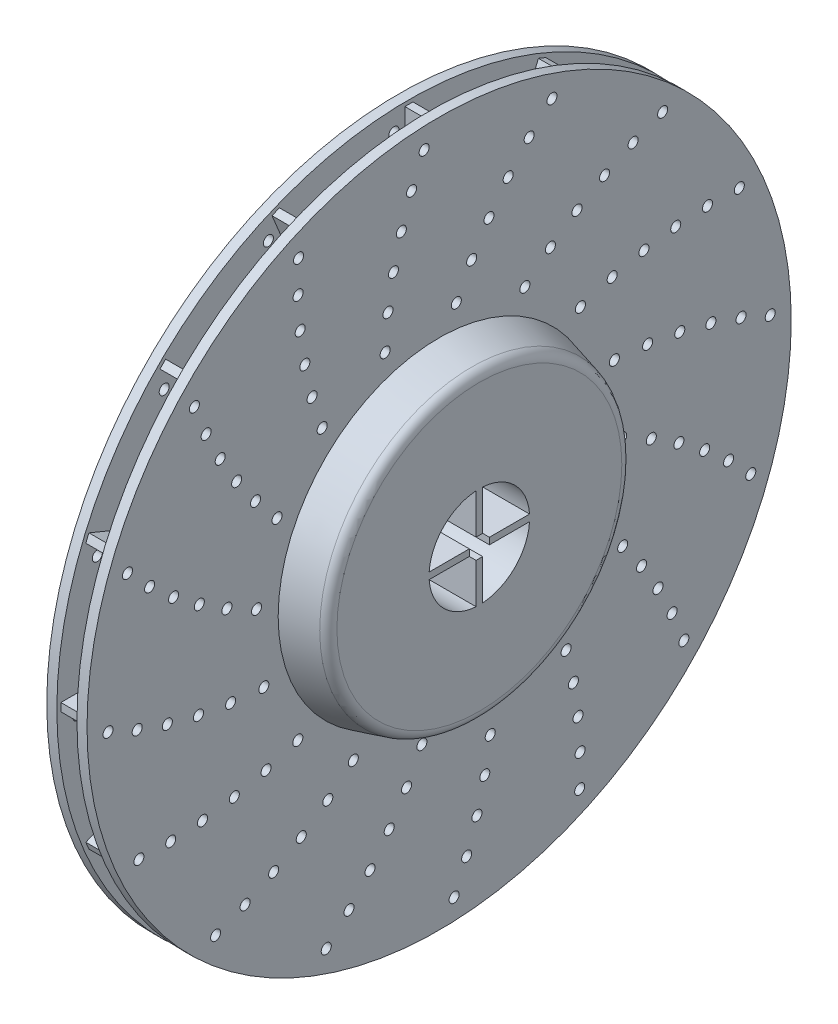
from build123d import *

# Parameters (mm, degrees)
Y_KSEKLIK_EKSTR_ZYON1_DEPTH   = 30
Y_KSEKLIK_EKSTR_ZYON1_2_DEPTH = 30
Y_KSEKLIK_EKSTR_ZYON1_3_DEPTH = 30
Y_KSEKLIK_EKSTR_ZYON1_4_DEPTH = 30
IZIM3_R                       = 25
IZIM3_R_2                     = 12.5
Y_KSEKLIK_EKSTR_ZYON2_DEPTH   = 30
Y_KSEKLIK_EKSTR_ZYON5_START   = -20
IZIM4_R                       = 87.5
IZIM4_R_2                     = 25
Y_KSEKLIK_EKSTR_ZYON5_DEPTH   = 10
IZIM9_R                       = 87.5
IZIM9_R_2                     = 37.5
KES_EKSTR_ZYON1_DEPTH         = 2.5
Y_KSEKLIK_EKSTR_ZYON9_DEPTH   = 2.5
IZIM14_R                      = 1.25
KES_EKSTR_ZYON2_DEPTH         = 5


with BuildPart() as part:
    # Çizim2 → Yükseklik-Ekstrüzyon1 (new body)
    with BuildSketch(Plane(origin=(0, 0, 0), x_dir=(0, 0, -1), z_dir=(1, 0, 0))):
        with BuildLine():
            Line((0.820112771, 2.5), (0.820112771, 12.473067587))
            ThreePointArc((0.820112771, 12.473067587), (0, 12.5), (-0.820112771, 12.473067587))
            Line((-0.820112771, 12.473067587), (-0.820112771, 2.5))
            Line((-0.820112771, 2.5), (0.820112771, 2.5))
        make_face()
    extrude(amount=Y_KSEKLIK_EKSTR_ZYON1_DEPTH)



with BuildPart() as body_2:
    # Çizim2 → Y_kseklik-Ekstr_zyon1 2 (new body)
    with BuildSketch(Plane(origin=(0, 0, 0), x_dir=(0, 0, -1), z_dir=(1, 0, 0))):
        with BuildLine():
            Line((12.473067587, 0.820112771), (2.5, 0.820112771))
            Line((2.5, 0.820112771), (2.5, -0.820112771))
            Line((2.5, -0.820112771), (12.473067587, -0.820112771))
            ThreePointArc((12.473067587, -0.820112771), (12.5, 0), (12.473067587, 0.820112771))
        make_face()
    extrude(amount=Y_KSEKLIK_EKSTR_ZYON1_2_DEPTH)


with BuildPart() as body_3:
    # Çizim2 → Y_kseklik-Ekstr_zyon1 3 (new body)
    with BuildSketch(Plane(origin=(0, 0, 0), x_dir=(0, 0, -1), z_dir=(1, 0, 0))):
        with BuildLine():
            Line((-2.5, 0.820112771), (-12.473067587, 0.820112771))
            ThreePointArc((-12.473067587, 0.820112771), (-12.5, 0), (-12.473067587, -0.820112771))
            Line((-12.473067587, -0.820112771), (-2.5, -0.820112771))
            Line((-2.5, -0.820112771), (-2.5, 0.820112771))
        make_face()
    extrude(amount=Y_KSEKLIK_EKSTR_ZYON1_3_DEPTH)


with BuildPart() as body_4:
    # Çizim2 → Y_kseklik-Ekstr_zyon1 4 (new body)
    with BuildSketch(Plane(origin=(0, 0, 0), x_dir=(0, 0, -1), z_dir=(1, 0, 0))):
        with BuildLine():
            Line((-0.820112771, -2.5), (-0.820112771, -12.473067587))
            ThreePointArc((-0.820112771, -12.473067587), (0, -12.5), (0.820112771, -12.473067587))
            Line((0.820112771, -12.473067587), (0.820112771, -2.5))
            Line((0.820112771, -2.5), (-0.820112771, -2.5))
        make_face()
    extrude(amount=Y_KSEKLIK_EKSTR_ZYON1_4_DEPTH)


with BuildPart() as part_1:
    add(part.part)

    add(body_2.part)  # Yükseklik-Ekstrüzyon2 merges body 2

    add(body_3.part)  # Yükseklik-Ekstrüzyon2 merges body 3

    add(body_4.part)  # Yükseklik-Ekstrüzyon2 merges body 4
    # Çizim3 → Yükseklik-Ekstrüzyon2 (add)
    with BuildSketch(Plane(origin=(0, 0, 0), x_dir=(0, 0, -1), z_dir=(1, 0, 0))):
        Circle(IZIM3_R)
        Circle(IZIM3_R_2, mode=Mode.SUBTRACT)
    extrude(amount=Y_KSEKLIK_EKSTR_ZYON2_DEPTH)

    # Çizim4 → Yükseklik-Ekstrüzyon5 (add)
    with BuildSketch(Plane(origin=(30, 0, 0), x_dir=(0, 0, -1), z_dir=(1, 0, 0)).offset(Y_KSEKLIK_EKSTR_ZYON5_START)):
        Circle(IZIM4_R)
        Circle(IZIM4_R_2, mode=Mode.SUBTRACT)
    extrude(amount=Y_KSEKLIK_EKSTR_ZYON5_DEPTH)

    # Çizim9 → Kes-Ekstrüzyon1 (cut, symmetric)
    with BuildSketch(Plane(origin=(15, 0, 0), x_dir=(0, 0, -1), z_dir=(1, 0, 0))):
        Circle(IZIM9_R)
        Circle(IZIM9_R_2, mode=Mode.SUBTRACT)
    extrude(amount=KES_EKSTR_ZYON1_DEPTH, both=True, mode=Mode.SUBTRACT)

    # Çizim10 → Yükseklik-Ekstrüzyon9 (add, symmetric)
    with BuildSketch(Plane(origin=(15, 0, 0), x_dir=(0, 0, -1), z_dir=(1, 0, 0))):
        with BuildLine():
            Line((1, 37.486664295), (1, 86.49421946))
            ThreePointArc((1, 86.49421946), (0, 86.5), (-1, 86.49421946))
            Line((-1, 86.49421946), (-1, 37.486664295))
            ThreePointArc((-1, 37.486664295), (0, 37.5), (1, 37.486664295))
        make_face()
        with BuildLine():
            Line((15.269404893, 34.250478452), (34.023784315, 79.527555607))
            ThreePointArc((34.023784315, 79.527555607), (33.1021169, 79.915579562), (32.17602525, 80.292922472))
            Line((32.17602525, 80.292922472), (13.421645828, 35.015845317))
            ThreePointArc((13.421645828, 35.015845317), (14.350628714, 34.645482469), (15.269404893, 34.250478452))
        make_face()
        with BuildLine():
            Line((27.214181309, 25.799967746), (61.867755895, 60.453542332))
            ThreePointArc((61.867755895, 60.453542332), (61.164736573, 61.164736573), (60.453542332, 61.867755895))
            Line((60.453542332, 61.867755895), (25.799967746, 27.214181309))
            ThreePointArc((25.799967746, 27.214181309), (26.516504294, 26.516504294), (27.214181309, 25.799967746))
        make_face()
        with BuildLine():
            Line((35.015845317, 13.421645828), (80.292922472, 32.17602525))
            ThreePointArc((80.292922472, 32.17602525), (79.915579562, 33.1021169), (79.527555607, 34.023784315))
            Line((79.527555607, 34.023784315), (34.250478452, 15.269404893))
            ThreePointArc((34.250478452, 15.269404893), (34.645482469, 14.350628714), (35.015845317, 13.421645828))
        make_face()
        with BuildLine():
            Line((37.486664295, -1), (86.49421946, -1))
            ThreePointArc((86.49421946, -1), (86.5, 0), (86.49421946, 1))
            Line((86.49421946, 1), (37.486664295, 1))
            ThreePointArc((37.486664295, 1), (37.5, 0), (37.486664295, -1))
        make_face()
        with BuildLine():
            Line((34.250478452, -15.269404893), (79.527555607, -34.023784315))
            ThreePointArc((79.527555607, -34.023784315), (79.915579562, -33.1021169), (80.292922472, -32.17602525))
            Line((80.292922472, -32.17602525), (35.015845317, -13.421645828))
            ThreePointArc((35.015845317, -13.421645828), (34.645482469, -14.350628714), (34.250478452, -15.269404893))
        make_face()
        with BuildLine():
            Line((25.799967746, -27.214181309), (60.453542332, -61.867755895))
            ThreePointArc((60.453542332, -61.867755895), (61.164736573, -61.164736573), (61.867755895, -60.453542332))
            Line((61.867755895, -60.453542332), (27.214181309, -25.799967746))
            ThreePointArc((27.214181309, -25.799967746), (26.516504294, -26.516504294), (25.799967746, -27.214181309))
        make_face()
        with BuildLine():
            Line((13.421645828, -35.015845317), (32.17602525, -80.292922472))
            ThreePointArc((32.17602525, -80.292922472), (33.1021169, -79.915579562), (34.023784315, -79.527555607))
            Line((34.023784315, -79.527555607), (15.269404893, -34.250478452))
            ThreePointArc((15.269404893, -34.250478452), (14.350628714, -34.645482469), (13.421645828, -35.015845317))
        make_face()
        with BuildLine():
            Line((-1, -37.486664295), (-1, -86.49421946))
            ThreePointArc((-1, -86.49421946), (0, -86.5), (1, -86.49421946))
            Line((1, -86.49421946), (1, -37.486664295))
            ThreePointArc((1, -37.486664295), (0, -37.5), (-1, -37.486664295))
        make_face()
        with BuildLine():
            Line((-15.269404893, -34.250478452), (-34.023784315, -79.527555607))
            ThreePointArc((-34.023784315, -79.527555607), (-33.1021169, -79.915579562), (-32.17602525, -80.292922472))
            Line((-32.17602525, -80.292922472), (-13.421645828, -35.015845317))
            ThreePointArc((-13.421645828, -35.015845317), (-14.350628714, -34.645482469), (-15.269404893, -34.250478452))
        make_face()
        with BuildLine():
            Line((-27.214181309, -25.799967746), (-61.867755895, -60.453542332))
            ThreePointArc((-61.867755895, -60.453542332), (-61.164736573, -61.164736573), (-60.453542332, -61.867755895))
            Line((-60.453542332, -61.867755895), (-25.799967746, -27.214181309))
            ThreePointArc((-25.799967746, -27.214181309), (-26.516504294, -26.516504294), (-27.214181309, -25.799967746))
        make_face()
        with BuildLine():
            Line((-35.015845317, -13.421645828), (-80.292922472, -32.17602525))
            ThreePointArc((-80.292922472, -32.17602525), (-79.915579562, -33.1021169), (-79.527555607, -34.023784315))
            Line((-79.527555607, -34.023784315), (-34.250478452, -15.269404893))
            ThreePointArc((-34.250478452, -15.269404893), (-34.645482469, -14.350628714), (-35.015845317, -13.421645828))
        make_face()
        with BuildLine():
            Line((-37.486664295, 1), (-86.49421946, 1))
            ThreePointArc((-86.49421946, 1), (-86.5, 0), (-86.49421946, -1))
            Line((-86.49421946, -1), (-37.486664295, -1))
            ThreePointArc((-37.486664295, -1), (-37.5, 0), (-37.486664295, 1))
        make_face()
        with BuildLine():
            Line((-34.250478452, 15.269404893), (-79.527555607, 34.023784315))
            ThreePointArc((-79.527555607, 34.023784315), (-79.915579562, 33.1021169), (-80.292922472, 32.17602525))
            Line((-80.292922472, 32.17602525), (-35.015845317, 13.421645828))
            ThreePointArc((-35.015845317, 13.421645828), (-34.645482469, 14.350628714), (-34.250478452, 15.269404893))
        make_face()
        with BuildLine():
            Line((-25.799967746, 27.214181309), (-60.453542332, 61.867755895))
            ThreePointArc((-60.453542332, 61.867755895), (-61.164736573, 61.164736573), (-61.867755895, 60.453542332))
            Line((-61.867755895, 60.453542332), (-27.214181309, 25.799967746))
            ThreePointArc((-27.214181309, 25.799967746), (-26.516504294, 26.516504294), (-25.799967746, 27.214181309))
        make_face()
        with BuildLine():
            Line((-13.421645828, 35.015845317), (-32.17602525, 80.292922472))
            ThreePointArc((-32.17602525, 80.292922472), (-33.1021169, 79.915579562), (-34.023784315, 79.527555607))
            Line((-34.023784315, 79.527555607), (-15.269404893, 34.250478452))
            ThreePointArc((-15.269404893, 34.250478452), (-14.350628714, 34.645482469), (-13.421645828, 35.015845317))
        make_face()
    extrude(amount=Y_KSEKLIK_EKSTR_ZYON9_DEPTH, both=True)

    # Çizim14 → Kes-Ekstrüzyon2 (cut, symmetric)
    with BuildSketch(Plane(origin=(15, 0, 0), x_dir=(0, 0, -1), z_dir=(1, 0, 0))):
        with Locations((-35.110644984, -29.057881577)):
            Circle(IZIM14_R)
        with Locations((-43.007108659, -31.562514978)):
            Circle(IZIM14_R)
        with Locations((-50.903572335, -33.371464723)):
            Circle(IZIM14_R)
        with Locations((-58.80003601, -34.522700284)):
            Circle(IZIM14_R)
        with Locations((-66.696499686, -35.038947272)):
            Circle(IZIM14_R)
        with Locations((-74.592963361, -34.930054479)):
            Circle(IZIM14_R)
        with Locations((-82.282065259, -3.725671153)):
            Circle(IZIM14_R)
        with Locations((-75.028355558, -6.848120799)):
            Circle(IZIM14_R)
        with Locations((-67.53541522, -9.393016596)):
            Circle(IZIM14_R)
        with Locations((-59.799475275, -11.351259447)):
            Circle(IZIM14_R)
        with Locations((-51.811839009, -12.701853625)):
            Circle(IZIM14_R)
        with Locations((-43.557976133, -13.409719912)):
            Circle(IZIM14_R)
        with Locations((-77.444468611, 28.045911832)):
            Circle(IZIM14_R)
        with Locations((-71.937824431, 22.385269987)):
            Circle(IZIM14_R)
        with Locations((-65.989139673, 17.166668721)):
            Circle(IZIM14_R)
        with Locations((-59.591450188, 12.397072181)):
            Circle(IZIM14_R)
        with Locations((-52.728686545, 8.0925498)):
            Circle(IZIM14_R)
        with Locations((-45.37400027, 4.27995005)):
            Circle(IZIM14_R)
        with Locations((-60.816653652, 55.547758978)):
            Circle(IZIM14_R)
        with Locations((-57.895411652, 48.210706341)):
            Circle(IZIM14_R)
        with Locations((-54.396615803, 41.112884342)):
            Circle(IZIM14_R)
        with Locations((-50.311167008, 34.258061949)):
            Circle(IZIM14_R)
        with Locations((-45.618069541, 27.654935877)):
            Circle(IZIM14_R)
        with Locations((-40.282244182, 21.318036415)):
            Circle(IZIM14_R)
        with Locations((-34.930054479, 74.592963361)):
            Circle(IZIM14_R)
        with Locations((-35.038947272, 66.696499686)):
            Circle(IZIM14_R)
        with Locations((-34.522700284, 58.80003601)):
            Circle(IZIM14_R)
        with Locations((-33.371464723, 50.903572335)):
            Circle(IZIM14_R)
        with Locations((-31.562514978, 43.007108659)):
            Circle(IZIM14_R)
        with Locations((-29.057881577, 35.110644984)):
            Circle(IZIM14_R)
        with Locations((-3.725671153, 82.282065259)):
            Circle(IZIM14_R)
        with Locations((-6.848120799, 75.028355558)):
            Circle(IZIM14_R)
        with Locations((-9.393016596, 67.53541522)):
            Circle(IZIM14_R)
        with Locations((-11.351259447, 59.799475275)):
            Circle(IZIM14_R)
        with Locations((-12.701853625, 51.811839009)):
            Circle(IZIM14_R)
        with Locations((-13.409719912, 43.557976133)):
            Circle(IZIM14_R)
        with Locations((28.045911832, 77.444468611)):
            Circle(IZIM14_R)
        with Locations((22.385269987, 71.937824431)):
            Circle(IZIM14_R)
        with Locations((17.166668721, 65.989139673)):
            Circle(IZIM14_R)
        with Locations((12.397072181, 59.591450188)):
            Circle(IZIM14_R)
        with Locations((8.0925498, 52.728686545)):
            Circle(IZIM14_R)
        with Locations((4.27995005, 45.37400027)):
            Circle(IZIM14_R)
        with Locations((55.547758978, 60.816653652)):
            Circle(IZIM14_R)
        with Locations((48.210706341, 57.895411652)):
            Circle(IZIM14_R)
        with Locations((41.112884342, 54.396615803)):
            Circle(IZIM14_R)
        with Locations((34.258061949, 50.311167008)):
            Circle(IZIM14_R)
        with Locations((27.654935877, 45.618069541)):
            Circle(IZIM14_R)
        with Locations((21.318036415, 40.282244182)):
            Circle(IZIM14_R)
        with Locations((74.592963361, 34.930054479)):
            Circle(IZIM14_R)
        with Locations((66.696499686, 35.038947272)):
            Circle(IZIM14_R)
        with Locations((58.80003601, 34.522700284)):
            Circle(IZIM14_R)
        with Locations((50.903572335, 33.371464723)):
            Circle(IZIM14_R)
        with Locations((43.007108659, 31.562514978)):
            Circle(IZIM14_R)
        with Locations((35.110644984, 29.057881577)):
            Circle(IZIM14_R)
        with Locations((82.282065259, 3.725671153)):
            Circle(IZIM14_R)
        with Locations((75.028355558, 6.848120799)):
            Circle(IZIM14_R)
        with Locations((67.53541522, 9.393016596)):
            Circle(IZIM14_R)
        with Locations((59.799475275, 11.351259447)):
            Circle(IZIM14_R)
        with Locations((51.811839009, 12.701853625)):
            Circle(IZIM14_R)
        with Locations((43.557976133, 13.409719912)):
            Circle(IZIM14_R)
        with Locations((77.444468611, -28.045911832)):
            Circle(IZIM14_R)
        with Locations((71.937824431, -22.385269987)):
            Circle(IZIM14_R)
        with Locations((65.989139673, -17.166668721)):
            Circle(IZIM14_R)
        with Locations((59.591450188, -12.397072181)):
            Circle(IZIM14_R)
        with Locations((52.728686545, -8.0925498)):
            Circle(IZIM14_R)
        with Locations((45.37400027, -4.27995005)):
            Circle(IZIM14_R)
        with Locations((60.816653652, -55.547758978)):
            Circle(IZIM14_R)
        with Locations((57.895411652, -48.210706341)):
            Circle(IZIM14_R)
        with Locations((54.396615803, -41.112884342)):
            Circle(IZIM14_R)
        with Locations((50.311167008, -34.258061949)):
            Circle(IZIM14_R)
        with Locations((45.618069541, -27.654935877)):
            Circle(IZIM14_R)
        with Locations((40.282244182, -21.318036415)):
            Circle(IZIM14_R)
        with Locations((34.930054479, -74.592963361)):
            Circle(IZIM14_R)
        with Locations((35.038947272, -66.696499686)):
            Circle(IZIM14_R)
        with Locations((34.522700284, -58.80003601)):
            Circle(IZIM14_R)
        with Locations((33.371464723, -50.903572335)):
            Circle(IZIM14_R)
        with Locations((31.562514978, -43.007108659)):
            Circle(IZIM14_R)
        with Locations((29.057881577, -35.110644984)):
            Circle(IZIM14_R)
        with Locations((3.725671153, -82.282065259)):
            Circle(IZIM14_R)
        with Locations((6.848120799, -75.028355558)):
            Circle(IZIM14_R)
        with Locations((9.393016596, -67.53541522)):
            Circle(IZIM14_R)
        with Locations((11.351259447, -59.799475275)):
            Circle(IZIM14_R)
        with Locations((12.701853625, -51.811839009)):
            Circle(IZIM14_R)
        with Locations((13.409719912, -43.557976133)):
            Circle(IZIM14_R)
        with Locations((-28.045911832, -77.444468611)):
            Circle(IZIM14_R)
        with Locations((-22.385269987, -71.937824431)):
            Circle(IZIM14_R)
        with Locations((-17.166668721, -65.989139673)):
            Circle(IZIM14_R)
        with Locations((-12.397072181, -59.591450188)):
            Circle(IZIM14_R)
        with Locations((-8.0925498, -52.728686545)):
            Circle(IZIM14_R)
        with Locations((-4.27995005, -45.37400027)):
            Circle(IZIM14_R)
        with Locations((-55.547758978, -60.816653652)):
            Circle(IZIM14_R)
        with Locations((-48.210706341, -57.895411652)):
            Circle(IZIM14_R)
        with Locations((-41.112884342, -54.396615803)):
            Circle(IZIM14_R)
        with Locations((-34.258061949, -50.311167008)):
            Circle(IZIM14_R)
        with Locations((-27.654935877, -45.618069541)):
            Circle(IZIM14_R)
        with Locations((-21.318036415, -40.282244182)):
            Circle(IZIM14_R)
    extrude(amount=KES_EKSTR_ZYON2_DEPTH, both=True, mode=Mode.SUBTRACT)

    # Çizim18 → Döndür3 (revolve)
    with BuildSketch(Plane.XY, mode=Mode.PRIVATE) as d_nd_r3_sk:
        with BuildLine():
            Line((0, 25), (0, 35.402190606))
            ThreePointArc((0, 35.402190606), (0.516616649, 36.924094178), (1.852952387, 37.817005171))
            Line((1.852952387, 37.817005171), (10, 40))
            Line((10, 40), (10, 25))
            Line((10, 25), (0, 25))
        make_face()
        with BuildLine():
            Line((30, 25), (20, 25))
            Line((20, 25), (20, 40))
            Line((20, 40), (28.147047613, 37.817005171))
            ThreePointArc((28.147047613, 37.817005171), (29.483383351, 36.924094178), (30, 35.402190606))
            Line((30, 35.402190606), (30, 25))
        make_face()
    revolve(d_nd_r3_sk.sketch.rotate(Axis((0, 0, 0), (1, 0, 0)), 90), axis=Axis((0, 0, 0), (1, 0, 0)))


solid = part_1.part
